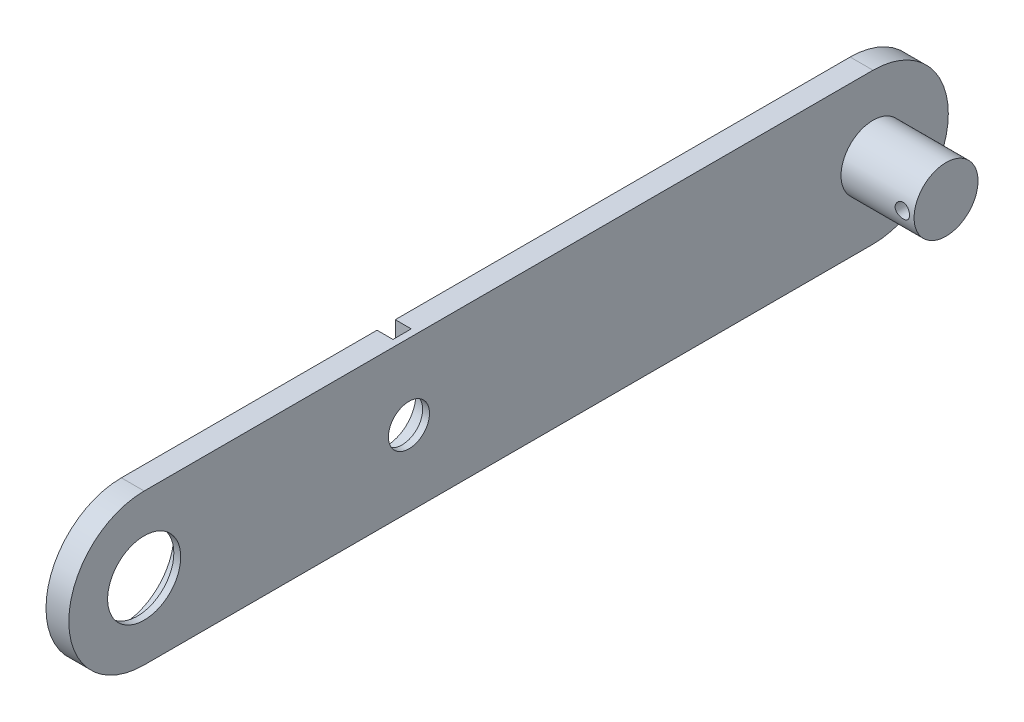
from build123d import *

# Parameters (mm, degrees)
SKETCH3_R           = 6.5
SKETCH3_R_2         = 11.5
BOSS_EXTRUDE2_DEPTH = 3.5
BOSS_EXTRUDE3_START = 1.5
SKETCH4_R           = 8
SKETCH4_R_2         = 4.5
BOSS_EXTRUDE3_DEPTH = 1.5
SKETCH6_R           = 7
BOSS_EXTRUDE4_DEPTH = 16
CUT_EXTRUDE1_START  = -3.5
CUT_EXTRUDE1_DEPTH  = 3.5
SKETCH8_R           = 1.575
CUT_EXTRUDE2_DEPTH  = 3


with BuildPart() as part:
    # Sketch3 → Boss-Extrude2 (new body)
    with BuildSketch(Plane(origin=(0, 20, 0), x_dir=(0, 1, 0), z_dir=(-1, 0, 0))):
        with BuildLine():
            Line((-3.5, 101.628977271), (-3.5, -57.9976886))
            ThreePointArc((-3.5, -57.9976886), (-20, -74.4976886), (-36.5, -57.9976886))
            Line((-36.5, -57.9976886), (-36.5, 101.628977271))
            ThreePointArc((-36.5, 101.628977271), (-20, 118.128977271), (-3.5, 101.628977271))
        make_face()
        with Locations(Location((-20, 0, 0), (0, 0, 270))):
            Circle(SKETCH3_R, mode=Mode.SUBTRACT)
        with Locations(Location((-20, -57.9976886, 0), (0, 0, 270))):
            Circle(SKETCH3_R_2, mode=Mode.SUBTRACT)
    extrude(amount=BOSS_EXTRUDE2_DEPTH)

    # Sketch4 → Boss-Extrude3 (add)
    with BuildSketch(Plane(origin=(0, 0, 0), x_dir=(0, 0, -1), z_dir=(1, 0, 0)).offset(BOSS_EXTRUDE3_START)):
        with BuildLine():
            Line((101.628977271, 16.5), (-57.9976886, 16.5))
            ThreePointArc((-57.9976886, 16.5), (-74.4976886, 0), (-57.9976886, -16.5))
            Line((-57.9976886, -16.5), (101.628977271, -16.5))
            ThreePointArc((101.628977271, -16.5), (118.128977271, 0), (101.628977271, 16.5))
        make_face()
        with Locations((-57.9976886, 0)):
            Circle(SKETCH4_R, mode=Mode.SUBTRACT)
        Circle(SKETCH4_R_2, mode=Mode.SUBTRACT)
    extrude(amount=-BOSS_EXTRUDE3_DEPTH)

    # Sketch6 → Boss-Extrude4 (add)
    with BuildSketch(Plane(origin=(1.5, 0, 0), x_dir=(0, 0, -1), z_dir=(1, 0, 0))):
        with Locations((101.628977271, 0)):
            Circle(SKETCH6_R)
    extrude(amount=BOSS_EXTRUDE4_DEPTH)

    # Sketch7 → Cut-Extrude1 (cut)
    with BuildSketch(Plane.ZY.offset(3.5).offset(CUT_EXTRUDE1_START)):
        with BuildLine():
            Line((-2, 16.5), (-2, 6.184658438))
            ThreePointArc((-2, 6.184658438), (0, 6.5), (2, 6.184658438))
            Line((2, 6.184658438), (2, 16.5))
            Line((2, 16.5), (-2, 16.5))
        make_face()
    extrude(amount=CUT_EXTRUDE1_DEPTH, mode=Mode.SUBTRACT)

    # Sketch8 → Cut-Extrude2 (cut)
    with BuildSketch(Plane.XY.offset(-94.628977271)):
        with Locations((14.925, 0)):
            Circle(SKETCH8_R)
    cut_extrude2 = extrude(amount=-CUT_EXTRUDE2_DEPTH, mode=Mode.SUBTRACT)

    # Mirror1: Cut-Extrude2 across plane
    add(cut_extrude2.mirror(Plane.XY.offset(-101.628977271)), mode=Mode.SUBTRACT)


solid = part.part
